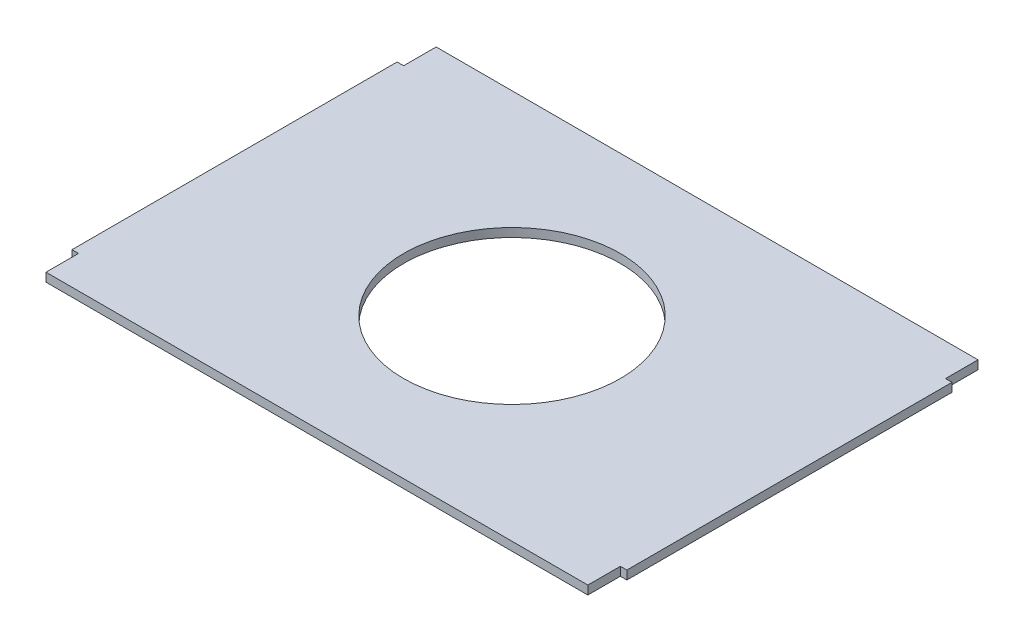
from build123d import *

# Parameters (mm, degrees)
SKETCH_4_R      = 50
EXTRUDE_3_DEPTH = 4


with BuildPart() as part:
    # 草图4 → 凸台-拉伸3 (new body)
    with BuildSketch(Plane(origin=(0, 0, 0), x_dir=(1, 0, 0), z_dir=(0, 1, 0))):
        Polygon((-125, 75), (-125, 90), (125, 90), (125, 75), (128, 75), (128, -75), (125, -75), (125, -90), (-125, -90), (-125, -75), (-128, -75), (-128, 75), align=None)
        with Locations(Location((0, 0, 0), (0, 0, 270))):
            Circle(SKETCH_4_R, mode=Mode.SUBTRACT)
    extrude(amount=EXTRUDE_3_DEPTH)


solid = part.part
